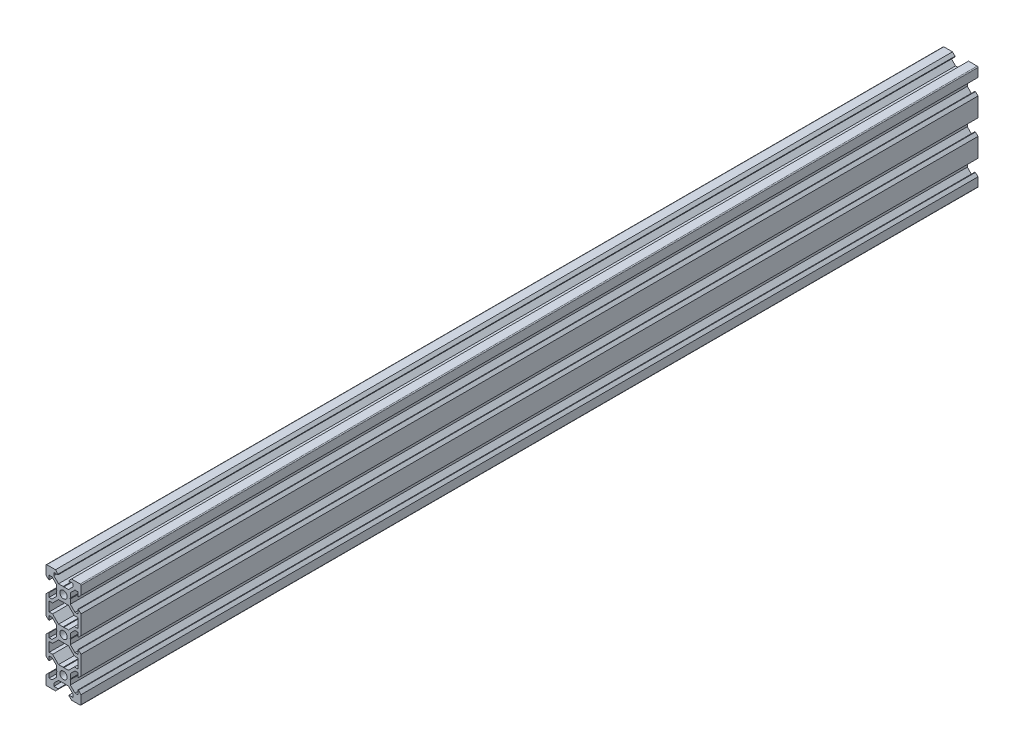
from build123d import *

# Parameters (mm, degrees)
BOSS_EXTRU_1_DEPTH = 512.76


with BuildPart() as part:
    # Esquisse1 → Boss.-Extru.1 (new body)
    with BuildSketch(Plane.XY):
        with BuildLine():
            Line((-9.5, 10), (-4.58, 10))
            Line((-4.58, 10), (-3.125, 8.545))
            Line((-3.125, 8.545), (-3.125, 8.2))
            Line((-3.125, 8.2), (-5.5, 8.2))
            Line((-5.5, 8.2), (-5.5, 6.560660172))
            Line((-5.5, 6.560660172), (-2.839339828, 3.9))
            Line((-2.839339828, 3.9), (-0.21, 3.9))
            Line((-0.21, 3.9), (0, 3.69))
            Line((0, 3.69), (0, 2.1))
            ThreePointArc((0, 2.1), (-2.1, 0), (0, -2.1))
            Line((0, -2.1), (0, -3.69))
            Line((0, -3.69), (-0.21, -3.9))
            Line((-0.21, -3.9), (-2.839339828, -3.9))
            Line((-2.839339828, -3.9), (-6.239339828, -7.3))
            Line((-6.239339828, -7.3), (-8.2, -7.3))
            Line((-8.2, -7.3), (-8.2, -12.7))
            Line((-8.2, -12.7), (-6.239339828, -12.7))
            Line((-6.239339828, -12.7), (-2.839339828, -16.1))
            Line((-2.839339828, -16.1), (-0.21, -16.1))
            Line((-0.21, -16.1), (0, -16.31))
            Line((0, -16.31), (0, -17.9))
            ThreePointArc((0, -17.9), (-2.1, -20), (0, -22.1))
            Line((0, -22.1), (0, -23.69))
            Line((0, -23.69), (-0.21, -23.9))
            Line((-0.21, -23.9), (-2.839339828, -23.9))
            Line((-2.839339828, -23.9), (-6.239339828, -27.3))
            Line((-6.239339828, -27.3), (-8.2, -27.3))
            Line((-8.2, -27.3), (-8.2, -32.7))
            Line((-8.2, -32.7), (-6.239339828, -32.7))
            Line((-6.239339828, -32.7), (-2.839339828, -36.1))
            Line((-2.839339828, -36.1), (-0.21, -36.1))
            Line((-0.21, -36.1), (0, -36.31))
            Line((0, -36.31), (0, -37.9))
            ThreePointArc((0, -37.9), (-2.1, -40), (0, -42.1))
            Line((0, -42.1), (0, -43.69))
            Line((0, -43.69), (-0.21, -43.9))
            Line((-0.21, -43.9), (-2.839339828, -43.9))
            Line((-2.839339828, -43.9), (-5.5, -46.560660172))
            Line((-5.5, -46.560660172), (-5.5, -48.2))
            Line((-5.5, -48.2), (-3.125, -48.2))
            Line((-3.125, -48.2), (-3.125, -48.545))
            Line((-3.125, -48.545), (-4.58, -50))
            Line((-4.58, -50), (-9.5, -50))
            ThreePointArc((-9.5, -50), (-9.853553391, -49.853553391), (-10, -49.5))
            Line((-10, -49.5), (-10, -44.58))
            Line((-10, -44.58), (-8.545, -43.125))
            Line((-8.545, -43.125), (-8.2, -43.125))
            Line((-8.2, -43.125), (-8.2, -45.5))
            Line((-8.2, -45.5), (-6.560660172, -45.5))
            Line((-6.560660172, -45.5), (-3.9, -42.839339828))
            Line((-3.9, -42.839339828), (-3.9, -40.21))
            Line((-3.9, -40.21), (-3.69, -40))
            Line((-3.69, -40), (-3.9, -39.79))
            Line((-3.9, -39.79), (-3.9, -37.160660172))
            Line((-3.9, -37.160660172), (-6.560660172, -34.5))
            Line((-6.560660172, -34.5), (-8.2, -34.5))
            Line((-8.2, -34.5), (-8.2, -36.875))
            Line((-8.2, -36.875), (-8.545, -36.875))
            Line((-8.545, -36.875), (-10, -35.42))
            Line((-10, -35.42), (-10, -24.58))
            Line((-10, -24.58), (-8.545, -23.125))
            Line((-8.545, -23.125), (-8.2, -23.125))
            Line((-8.2, -23.125), (-8.2, -25.5))
            Line((-8.2, -25.5), (-6.560660172, -25.5))
            Line((-6.560660172, -25.5), (-3.9, -22.839339828))
            Line((-3.9, -22.839339828), (-3.9, -20.21))
            Line((-3.9, -20.21), (-3.69, -20))
            Line((-3.69, -20), (-3.9, -19.79))
            Line((-3.9, -19.79), (-3.9, -17.160660172))
            Line((-3.9, -17.160660172), (-6.560660172, -14.5))
            Line((-6.560660172, -14.5), (-8.2, -14.5))
            Line((-8.2, -14.5), (-8.2, -16.875))
            Line((-8.2, -16.875), (-8.545, -16.875))
            Line((-8.545, -16.875), (-10, -15.42))
            Line((-10, -15.42), (-10, -4.58))
            Line((-10, -4.58), (-8.545, -3.125))
            Line((-8.545, -3.125), (-8.2, -3.125))
            Line((-8.2, -3.125), (-8.2, -5.5))
            Line((-8.2, -5.5), (-6.560660172, -5.5))
            Line((-6.560660172, -5.5), (-3.9, -2.839339828))
            Line((-3.9, -2.839339828), (-3.9, -0.21))
            Line((-3.9, -0.21), (-3.69, 0))
            Line((-3.69, 0), (-3.9, 0.21))
            Line((-3.9, 0.21), (-3.9, 2.839339828))
            Line((-3.9, 2.839339828), (-6.560660172, 5.5))
            Line((-6.560660172, 5.5), (-8.2, 5.5))
            Line((-8.2, 5.5), (-8.2, 3.125))
            Line((-8.2, 3.125), (-8.545, 3.125))
            Line((-8.545, 3.125), (-10, 4.58))
            Line((-10, 4.58), (-10, 9.5))
            ThreePointArc((-10, 9.5), (-9.853553391, 9.853553391), (-9.5, 10))
        make_face()
    boss_extru_1 = extrude(amount=BOSS_EXTRU_1_DEPTH)

    # Symétrie1: Boss.-Extru.1 across plane
    add(boss_extru_1.mirror(Plane(origin=(0, 3.69, 512.76), x_dir=(0, 0, 1), z_dir=(-1, 0, 0))))


solid = part.part
